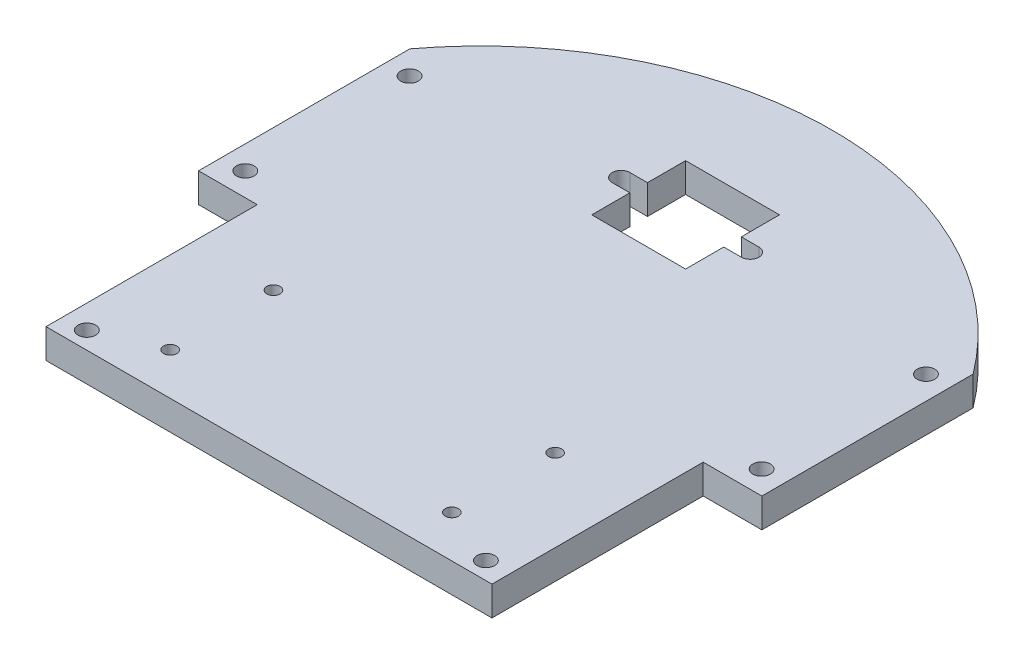
from build123d import *

# Parameters (mm, degrees)
SKETCH1_R           = 1.5
SKETCH1_R_2         = 1.125
BOSS_EXTRUDE1_DEPTH = 5


with BuildPart() as part:
    # Sketch1 → Boss-Extrude1 (new body)
    with BuildSketch(Plane(origin=(0, 0, 0), x_dir=(1, 0, 0), z_dir=(0, 1, 0))):
        with BuildLine():
            Line((-38, -51), (38, -51))
            Line((38, -51), (38, -15))
            Line((38, -15), (48, -15))
            Line((48, -15), (48, 21))
            ThreePointArc((48, 21), (0, 45), (-48, 21))
            Line((-48, 21), (-48, -15))
            Line((-48, -15), (-38, -15))
            Line((-38, -15), (-38, -51))
        make_face()
        with Locations(Location((34, -48.04, 0), (0, 0, 270))):
            Circle(SKETCH1_R, mode=Mode.SUBTRACT)
        with Locations(Location((-34, -48.04, 0), (0, 0, 270))):
            Circle(SKETCH1_R, mode=Mode.SUBTRACT)
        with Locations(Location((-44, -11.04, 0), (0, 0, 270))):
            Circle(SKETCH1_R, mode=Mode.SUBTRACT)
        with Locations(Location((-44, 16.96, 0), (0, 0, 270))):
            Circle(SKETCH1_R, mode=Mode.SUBTRACT)
        with Locations(Location((44, 16.96, 0), (0, 0, 270))):
            Circle(SKETCH1_R, mode=Mode.SUBTRACT)
        with Locations(Location((44, -11.04, 0), (0, 0, 270))):
            Circle(SKETCH1_R, mode=Mode.SUBTRACT)
        with Locations(Location((-24, -26.24, 0), (0, 0, 270))):
            Circle(SKETCH1_R_2, mode=Mode.SUBTRACT)
        with Locations(Location((-24, -43.84, 0), (0, 0, 270))):
            Circle(SKETCH1_R_2, mode=Mode.SUBTRACT)
        with Locations(Location((24, -26.24, 0), (0, 0, 270))):
            Circle(SKETCH1_R_2, mode=Mode.SUBTRACT)
        with Locations(Location((24, -43.84, 0), (0, 0, 270))):
            Circle(SKETCH1_R_2, mode=Mode.SUBTRACT)
        with BuildLine():
            Line((-8, 28), (8, 28))
            Line((8, 28), (8, 21.5))
            Line((8, 21.5), (11, 21.5))
            ThreePointArc((11, 21.5), (12.5, 20), (11, 18.5))
            Line((11, 18.5), (8, 18.5))
            Line((8, 18.5), (8, 12))
            Line((8, 12), (-8, 12))
            Line((-8, 12), (-8, 18.5))
            Line((-8, 18.5), (-11, 18.5))
            ThreePointArc((-11, 18.5), (-12.5, 20), (-11, 21.5))
            Line((-11, 21.5), (-8, 21.5))
            Line((-8, 21.5), (-8, 28))
        make_face(mode=Mode.SUBTRACT)
    extrude(amount=BOSS_EXTRUDE1_DEPTH)


solid = part.part
